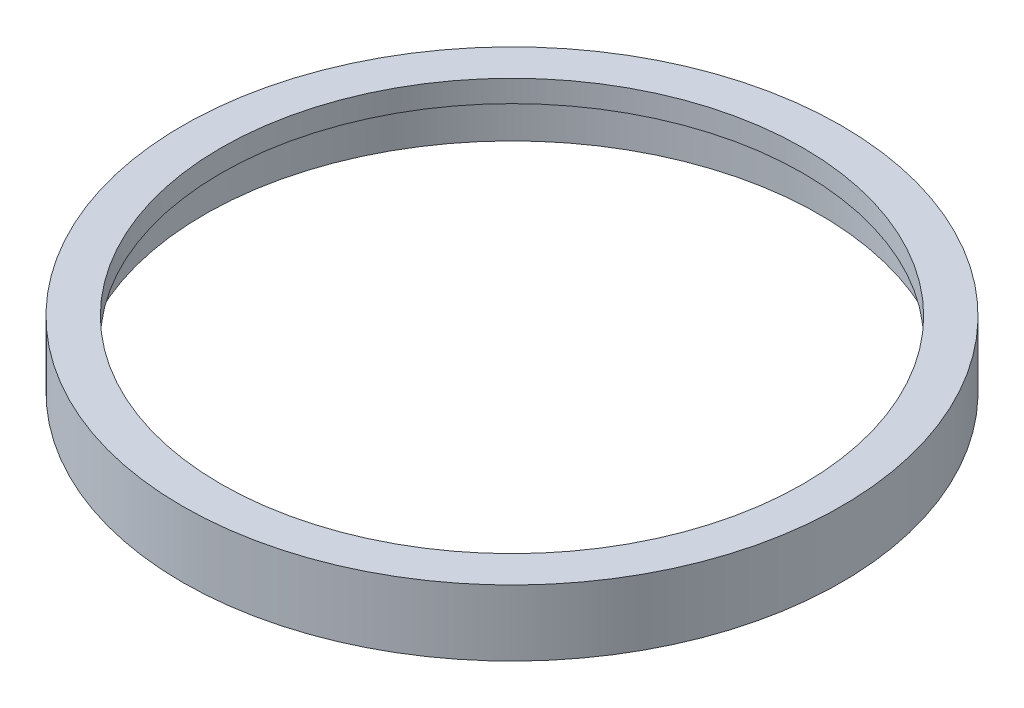
from build123d import *

# Parameters (mm, degrees)
CROQUIS1_R              = 15
CROQUIS1_R_2            = 14
SALIENTE_EXTRUIR1_DEPTH = 2
CROQUIS2_R              = 15
CROQUIS2_R_2            = 13.25
SALIENTE_EXTRUIR2_DEPTH = 1


with BuildPart() as part:
    # Croquis1 → Saliente-Extruir1 (new body)
    with BuildSketch(Plane(origin=(0, 0, 0), x_dir=(1, 0, 0), z_dir=(0, 1, 0))):
        with Locations(Location((0, 0, 0), (0, 0, 270))):
            Circle(CROQUIS1_R)
        with Locations(Location((0, 0, 0), (0, 0, 270))):
            Circle(CROQUIS1_R_2, mode=Mode.SUBTRACT)
    extrude(amount=SALIENTE_EXTRUIR1_DEPTH)

    # Croquis2 → Saliente-Extruir2 (add)
    with BuildSketch(Plane(origin=(0, 2, 0), x_dir=(1, 0, 0), z_dir=(0, 1, 0))):
        with Locations(Location((0, 0, 0), (0, 0, 270))):
            Circle(CROQUIS2_R)
        with Locations(Location((0, 0, 0), (0, 0, 270))):
            Circle(CROQUIS2_R_2, mode=Mode.SUBTRACT)
    extrude(amount=SALIENTE_EXTRUIR2_DEPTH)


solid = part.part
